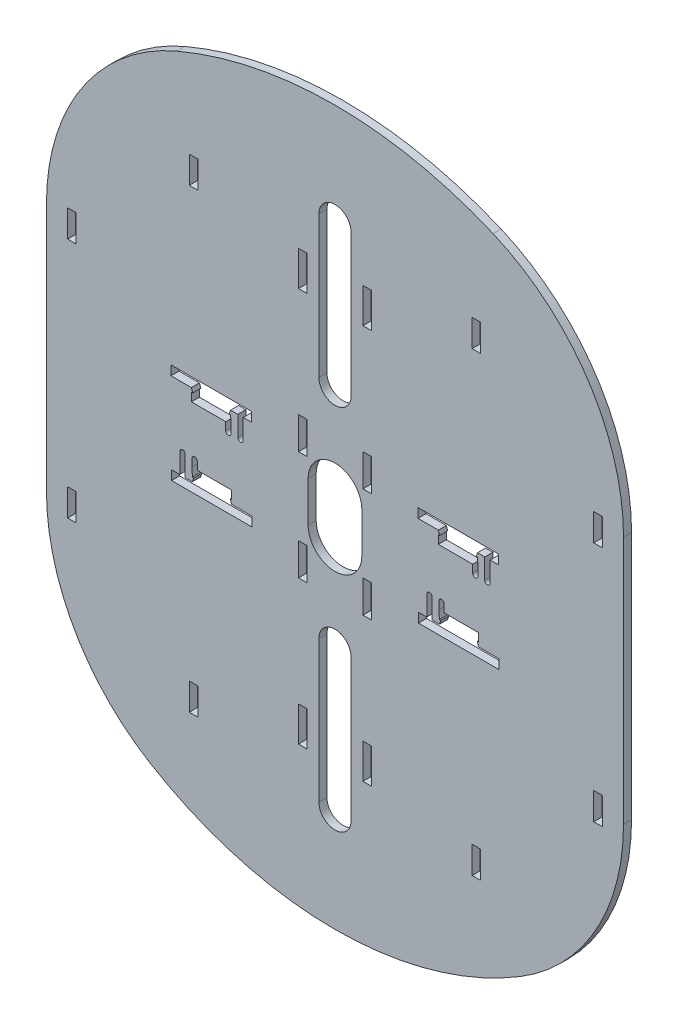
from build123d import *

# Parameters (mm, degrees)
BOSS_EXTRUDE1_DEPTH        = 3
SPINE_T_SLOTS_REACH        = 173.039
SPINE_MOUNTING_SLOTS_REACH = 173.039
SKETCH2_W                  = 3.2
SKETCH2_H                  = 12
SKETCH2_H_2                = 13
SIDE_PLATE_SLOTS_REACH     = 173.039
SKETCH5_W                  = 3.2
SKETCH5_H                  = 10.1
LINKAGE_CLEARANCE_REACH    = 173.039


with BuildPart() as part:
    # Sketch1 → Boss-Extrude1 (new body)
    with BuildSketch(Plane.XY):
        with BuildLine():
            Line((107.5, -45.307284183), (107.5, 47.371965948))
            ThreePointArc((107.5, 47.371965948), (94.261836832, 91.449819149), (58.928571429, 120.939927031))
            ThreePointArc((58.928571429, 120.939927031), (0, 133), (-58.928571429, 120.939927031))
            ThreePointArc((-58.928571429, 120.939927031), (-94.261836832, 91.449819149), (-107.5, 47.371965948))
            Line((-107.5, 47.371965948), (-107.5, -45.307284183))
            ThreePointArc((-107.5, -45.307284183), (-97.216406667, -84.545309636), (-69.009433962, -113.695637666))
            ThreePointArc((-69.009433962, -113.695637666), (0, -133), (69.009433962, -113.695637666))
            ThreePointArc((69.009433962, -113.695637666), (97.216406667, -84.545309636), (107.5, -45.307284183))
        make_face()
    extrude(amount=BOSS_EXTRUDE1_DEPTH)

    # Sketch4 → spine T-slots (cut, up to next)
    with BuildSketch(Plane.XY.offset(3), mode=Mode.PRIVATE) as spine_t_slots_sk1:
        with BuildLine():
            Line((60.9, 18.6), (30.9, 18.6))
            Line((30.9, 18.6), (30.9, 15.1))
            Line((30.9, 15.1), (38.5, 15.1))
            Line((38.5, 15.1), (39, 13.6))
            Line((39, 13.6), (38.5, 13.6))
            Line((38.5, 13.6), (38.5, 10.5))
            Line((38.5, 10.5), (51.3, 10.5))
            Line((51.3, 10.5), (51.3, 7.6))
            ThreePointArc((51.3, 7.6), (52.3, 6.6), (53.3, 7.6))
            Line((53.3, 7.6), (53.3, 10.5))
            Line((53.3, 10.5), (53.1, 13.6))
            Line((53.1, 13.6), (52.6, 13.6))
            Line((52.6, 13.6), (53.1, 15.1))
            Line((53.1, 15.1), (55.8, 15.1))
            Line((55.8, 15.1), (55.8, 7.6))
            ThreePointArc((55.8, 7.6), (56.8, 6.6), (57.8, 7.6))
            Line((57.8, 7.6), (57.8, 15.1))
            Line((57.8, 15.1), (60.9, 15.1))
            Line((60.9, 15.1), (60.9, 18.6))
        make_face()
    spine_t_slots_tool1 = extrude(spine_t_slots_sk1.sketch, amount=-SPINE_T_SLOTS_REACH, mode=Mode.PRIVATE) & part.part
    # Sketch4 → spine T-slots (cut, up to next)
    with BuildSketch(Plane.XY.offset(3), mode=Mode.PRIVATE) as spine_t_slots_sk2:
        with BuildLine():
            Line((31.1, -18.6), (61.1, -18.6))
            Line((61.1, -18.6), (61.1, -15.1))
            Line((61.1, -15.1), (53.5, -15.1))
            Line((53.5, -15.1), (53, -13.6))
            Line((53, -13.6), (53.5, -13.6))
            Line((53.5, -13.6), (53.5, -10.5))
            Line((53.5, -10.5), (40.7, -10.5))
            Line((40.7, -10.5), (40.7, -7.6))
            ThreePointArc((40.7, -7.6), (39.7, -6.6), (38.7, -7.6))
            Line((38.7, -7.6), (38.7, -10.5))
            Line((38.7, -10.5), (38.9, -13.6))
            Line((38.9, -13.6), (39.4, -13.6))
            Line((39.4, -13.6), (38.9, -15.1))
            Line((38.9, -15.1), (36.2, -15.1))
            Line((36.2, -15.1), (36.2, -7.6))
            ThreePointArc((36.2, -7.6), (35.2, -6.6), (34.2, -7.6))
            Line((34.2, -7.6), (34.2, -15.1))
            Line((34.2, -15.1), (31.1, -15.1))
            Line((31.1, -15.1), (31.1, -18.6))
        make_face()
    spine_t_slots_tool2 = extrude(spine_t_slots_sk2.sketch, amount=-SPINE_T_SLOTS_REACH, mode=Mode.PRIVATE) & part.part
    # Sketch4 → spine T-slots (cut, up to next)
    with BuildSketch(Plane.XY.offset(3), mode=Mode.PRIVATE) as spine_t_slots_sk3:
        with BuildLine():
            Line((-60.9, -18.6), (-30.9, -18.6))
            Line((-30.9, -18.6), (-30.9, -15.1))
            Line((-30.9, -15.1), (-38.5, -15.1))
            Line((-38.5, -15.1), (-39, -13.6))
            Line((-39, -13.6), (-38.5, -13.6))
            Line((-38.5, -13.6), (-38.5, -10.5))
            Line((-38.5, -10.5), (-51.3, -10.5))
            Line((-51.3, -10.5), (-51.3, -7.6))
            ThreePointArc((-51.3, -7.6), (-52.3, -6.6), (-53.3, -7.6))
            Line((-53.3, -7.6), (-53.3, -10.5))
            Line((-53.3, -10.5), (-53.1, -13.6))
            Line((-53.1, -13.6), (-52.6, -13.6))
            Line((-52.6, -13.6), (-53.1, -15.1))
            Line((-53.1, -15.1), (-55.8, -15.1))
            Line((-55.8, -15.1), (-55.8, -7.6))
            ThreePointArc((-55.8, -7.6), (-56.8, -6.6), (-57.8, -7.6))
            Line((-57.8, -7.6), (-57.8, -15.1))
            Line((-57.8, -15.1), (-60.9, -15.1))
            Line((-60.9, -15.1), (-60.9, -18.6))
        make_face()
    spine_t_slots_tool3 = extrude(spine_t_slots_sk3.sketch, amount=-SPINE_T_SLOTS_REACH, mode=Mode.PRIVATE) & part.part
    # Sketch4 → spine T-slots (cut, up to next)
    with BuildSketch(Plane.XY.offset(3), mode=Mode.PRIVATE) as spine_t_slots_sk4:
        with BuildLine():
            Line((-31.1, 18.6), (-61.1, 18.6))
            Line((-61.1, 18.6), (-61.1, 15.1))
            Line((-61.1, 15.1), (-53.5, 15.1))
            Line((-53.5, 15.1), (-53, 13.6))
            Line((-53, 13.6), (-53.5, 13.6))
            Line((-53.5, 13.6), (-53.5, 10.5))
            Line((-53.5, 10.5), (-40.7, 10.5))
            Line((-40.7, 10.5), (-40.7, 7.6))
            ThreePointArc((-40.7, 7.6), (-39.7, 6.6), (-38.7, 7.6))
            Line((-38.7, 7.6), (-38.7, 10.5))
            Line((-38.7, 10.5), (-38.9, 13.6))
            Line((-38.9, 13.6), (-39.4, 13.6))
            Line((-39.4, 13.6), (-38.9, 15.1))
            Line((-38.9, 15.1), (-36.2, 15.1))
            Line((-36.2, 15.1), (-36.2, 7.6))
            ThreePointArc((-36.2, 7.6), (-35.2, 6.6), (-34.2, 7.6))
            Line((-34.2, 7.6), (-34.2, 15.1))
            Line((-34.2, 15.1), (-31.1, 15.1))
            Line((-31.1, 15.1), (-31.1, 18.6))
        make_face()
    spine_t_slots_tool4 = extrude(spine_t_slots_sk4.sketch, amount=-SPINE_T_SLOTS_REACH, mode=Mode.PRIVATE) & part.part
    add(spine_t_slots_tool1.solids().sort_by_distance((47.0418, 14.653776, 3))[0], mode=Mode.SUBTRACT)
    add(spine_t_slots_tool2.solids().sort_by_distance((44.9582, -14.653776, 3))[0], mode=Mode.SUBTRACT)
    add(spine_t_slots_tool3.solids().sort_by_distance((-47.0418, -14.653776, 3))[0], mode=Mode.SUBTRACT)
    add(spine_t_slots_tool4.solids().sort_by_distance((-44.9582, 14.653776, 3))[0], mode=Mode.SUBTRACT)

    # Sketch2 → spine mounting slots (cut, up to next)
    with BuildSketch(Plane.XY.offset(3), mode=Mode.PRIVATE) as spine_mounting_slots_sk1:
        with Locations((12, 20.36)):
            Rectangle(SKETCH2_W, SKETCH2_H)
    spine_mounting_slots_tool1 = extrude(spine_mounting_slots_sk1.sketch, amount=-SPINE_MOUNTING_SLOTS_REACH, mode=Mode.PRIVATE) & part.part
    # Sketch2 → spine mounting slots (cut, up to next)
    with BuildSketch(Plane.XY.offset(3), mode=Mode.PRIVATE) as spine_mounting_slots_sk2:
        with Locations((12, 73.5)):
            Rectangle(SKETCH2_W, SKETCH2_H_2)
    spine_mounting_slots_tool2 = extrude(spine_mounting_slots_sk2.sketch, amount=-SPINE_MOUNTING_SLOTS_REACH, mode=Mode.PRIVATE) & part.part
    # Sketch2 → spine mounting slots (cut, up to next)
    with BuildSketch(Plane.XY.offset(3), mode=Mode.PRIVATE) as spine_mounting_slots_sk3:
        with Locations((-12, 73.5)):
            Rectangle(SKETCH2_W, SKETCH2_H_2)
    spine_mounting_slots_tool3 = extrude(spine_mounting_slots_sk3.sketch, amount=-SPINE_MOUNTING_SLOTS_REACH, mode=Mode.PRIVATE) & part.part
    # Sketch2 → spine mounting slots (cut, up to next)
    with BuildSketch(Plane.XY.offset(3), mode=Mode.PRIVATE) as spine_mounting_slots_sk4:
        with Locations((-12, 20.36)):
            Rectangle(SKETCH2_W, SKETCH2_H)
    spine_mounting_slots_tool4 = extrude(spine_mounting_slots_sk4.sketch, amount=-SPINE_MOUNTING_SLOTS_REACH, mode=Mode.PRIVATE) & part.part
    # Sketch2 → spine mounting slots (cut, up to next)
    with BuildSketch(Plane.XY.offset(3), mode=Mode.PRIVATE) as spine_mounting_slots_sk5:
        with Locations((-12, -20.36)):
            Rectangle(SKETCH2_W, SKETCH2_H)
    spine_mounting_slots_tool5 = extrude(spine_mounting_slots_sk5.sketch, amount=-SPINE_MOUNTING_SLOTS_REACH, mode=Mode.PRIVATE) & part.part
    # Sketch2 → spine mounting slots (cut, up to next)
    with BuildSketch(Plane.XY.offset(3), mode=Mode.PRIVATE) as spine_mounting_slots_sk6:
        with Locations((-12, -73.5)):
            Rectangle(SKETCH2_W, SKETCH2_H_2)
    spine_mounting_slots_tool6 = extrude(spine_mounting_slots_sk6.sketch, amount=-SPINE_MOUNTING_SLOTS_REACH, mode=Mode.PRIVATE) & part.part
    # Sketch2 → spine mounting slots (cut, up to next)
    with BuildSketch(Plane.XY.offset(3), mode=Mode.PRIVATE) as spine_mounting_slots_sk7:
        with Locations((12, -73.5)):
            Rectangle(SKETCH2_W, SKETCH2_H_2)
    spine_mounting_slots_tool7 = extrude(spine_mounting_slots_sk7.sketch, amount=-SPINE_MOUNTING_SLOTS_REACH, mode=Mode.PRIVATE) & part.part
    # Sketch2 → spine mounting slots (cut, up to next)
    with BuildSketch(Plane.XY.offset(3), mode=Mode.PRIVATE) as spine_mounting_slots_sk8:
        with Locations((12, -20.36)):
            Rectangle(SKETCH2_W, SKETCH2_H)
    spine_mounting_slots_tool8 = extrude(spine_mounting_slots_sk8.sketch, amount=-SPINE_MOUNTING_SLOTS_REACH, mode=Mode.PRIVATE) & part.part
    add(spine_mounting_slots_tool1.solids().sort_by_distance((12, 20.36, 3))[0], mode=Mode.SUBTRACT)
    add(spine_mounting_slots_tool2.solids().sort_by_distance((12, 73.5, 3))[0], mode=Mode.SUBTRACT)
    add(spine_mounting_slots_tool3.solids().sort_by_distance((-12, 73.5, 3))[0], mode=Mode.SUBTRACT)
    add(spine_mounting_slots_tool4.solids().sort_by_distance((-12, 20.36, 3))[0], mode=Mode.SUBTRACT)
    add(spine_mounting_slots_tool5.solids().sort_by_distance((-12, -20.36, 3))[0], mode=Mode.SUBTRACT)
    add(spine_mounting_slots_tool6.solids().sort_by_distance((-12, -73.5, 3))[0], mode=Mode.SUBTRACT)
    add(spine_mounting_slots_tool7.solids().sort_by_distance((12, -73.5, 3))[0], mode=Mode.SUBTRACT)
    add(spine_mounting_slots_tool8.solids().sort_by_distance((12, -20.36, 3))[0], mode=Mode.SUBTRACT)

    # Sketch5 → side plate slots (cut, up to next)
    with BuildSketch(Plane.XY.offset(3), mode=Mode.PRIVATE) as side_plate_slots_sk1:
        with Locations((52.69, 85)):
            Rectangle(SKETCH5_W, SKETCH5_H)
    side_plate_slots_tool1 = extrude(side_plate_slots_sk1.sketch, amount=-SIDE_PLATE_SLOTS_REACH, mode=Mode.PRIVATE) & part.part
    # Sketch5 → side plate slots (cut, up to next)
    with BuildSketch(Plane.XY.offset(3), mode=Mode.PRIVATE) as side_plate_slots_sk2:
        with Locations((52.69, -85)):
            Rectangle(SKETCH5_W, SKETCH5_H)
    side_plate_slots_tool2 = extrude(side_plate_slots_sk2.sketch, amount=-SIDE_PLATE_SLOTS_REACH, mode=Mode.PRIVATE) & part.part
    # Sketch5 → side plate slots (cut, up to next)
    with BuildSketch(Plane.XY.offset(3), mode=Mode.PRIVATE) as side_plate_slots_sk3:
        with Locations((-52.69, 85)):
            Rectangle(SKETCH5_W, SKETCH5_H)
    side_plate_slots_tool3 = extrude(side_plate_slots_sk3.sketch, amount=-SIDE_PLATE_SLOTS_REACH, mode=Mode.PRIVATE) & part.part
    # Sketch5 → side plate slots (cut, up to next)
    with BuildSketch(Plane.XY.offset(3), mode=Mode.PRIVATE) as side_plate_slots_sk4:
        with Locations((-52.69, -85)):
            Rectangle(SKETCH5_W, SKETCH5_H)
    side_plate_slots_tool4 = extrude(side_plate_slots_sk4.sketch, amount=-SIDE_PLATE_SLOTS_REACH, mode=Mode.PRIVATE) & part.part
    # Sketch5 → side plate slots (cut, up to next)
    with BuildSketch(Plane.XY.offset(3), mode=Mode.PRIVATE) as side_plate_slots_sk5:
        with Locations((98, 45)):
            Rectangle(SKETCH5_W, SKETCH5_H)
    side_plate_slots_tool5 = extrude(side_plate_slots_sk5.sketch, amount=-SIDE_PLATE_SLOTS_REACH, mode=Mode.PRIVATE) & part.part
    # Sketch5 → side plate slots (cut, up to next)
    with BuildSketch(Plane.XY.offset(3), mode=Mode.PRIVATE) as side_plate_slots_sk6:
        with Locations((98, -45)):
            Rectangle(SKETCH5_W, SKETCH5_H)
    side_plate_slots_tool6 = extrude(side_plate_slots_sk6.sketch, amount=-SIDE_PLATE_SLOTS_REACH, mode=Mode.PRIVATE) & part.part
    # Sketch5 → side plate slots (cut, up to next)
    with BuildSketch(Plane.XY.offset(3), mode=Mode.PRIVATE) as side_plate_slots_sk7:
        with Locations((-98, -45)):
            Rectangle(SKETCH5_W, SKETCH5_H)
    side_plate_slots_tool7 = extrude(side_plate_slots_sk7.sketch, amount=-SIDE_PLATE_SLOTS_REACH, mode=Mode.PRIVATE) & part.part
    # Sketch5 → side plate slots (cut, up to next)
    with BuildSketch(Plane.XY.offset(3), mode=Mode.PRIVATE) as side_plate_slots_sk8:
        with Locations((-98, 45)):
            Rectangle(SKETCH5_W, SKETCH5_H)
    side_plate_slots_tool8 = extrude(side_plate_slots_sk8.sketch, amount=-SIDE_PLATE_SLOTS_REACH, mode=Mode.PRIVATE) & part.part
    add(side_plate_slots_tool1.solids().sort_by_distance((52.69, 85, 3))[0], mode=Mode.SUBTRACT)
    add(side_plate_slots_tool2.solids().sort_by_distance((52.69, -85, 3))[0], mode=Mode.SUBTRACT)
    add(side_plate_slots_tool3.solids().sort_by_distance((-52.69, 85, 3))[0], mode=Mode.SUBTRACT)
    add(side_plate_slots_tool4.solids().sort_by_distance((-52.69, -85, 3))[0], mode=Mode.SUBTRACT)
    add(side_plate_slots_tool5.solids().sort_by_distance((98, 45, 3))[0], mode=Mode.SUBTRACT)
    add(side_plate_slots_tool6.solids().sort_by_distance((98, -45, 3))[0], mode=Mode.SUBTRACT)
    add(side_plate_slots_tool7.solids().sort_by_distance((-98, -45, 3))[0], mode=Mode.SUBTRACT)
    add(side_plate_slots_tool8.solids().sort_by_distance((-98, 45, 3))[0], mode=Mode.SUBTRACT)

    # Sketch3 → linkage clearance (cut, up to next)
    with BuildSketch(Plane.XY.offset(3), mode=Mode.PRIVATE) as linkage_clearance_sk1:
        with BuildLine():
            Line((-6, -94.913476789), (-6, -42.110007057))
            ThreePointArc((-6, -42.110007057), (0, -36.110007057), (6, -42.110007057))
            Line((6, -42.110007057), (6, -94.913476789))
            ThreePointArc((6, -94.913476789), (0, -100.913476789), (-6, -94.913476789))
        make_face()
    linkage_clearance_tool1 = extrude(linkage_clearance_sk1.sketch, amount=-LINKAGE_CLEARANCE_REACH, mode=Mode.PRIVATE) & part.part
    # Sketch3 → linkage clearance (cut, up to next)
    with BuildSketch(Plane.XY.offset(3), mode=Mode.PRIVATE) as linkage_clearance_sk2:
        with BuildLine():
            Line((-6, 94.913476789), (-6, 42.110007057))
            ThreePointArc((-6, 42.110007057), (0, 36.110007057), (6, 42.110007057))
            Line((6, 42.110007057), (6, 94.913476789))
            ThreePointArc((6, 94.913476789), (0, 100.913476789), (-6, 94.913476789))
        make_face()
    linkage_clearance_tool2 = extrude(linkage_clearance_sk2.sketch, amount=-LINKAGE_CLEARANCE_REACH, mode=Mode.PRIVATE) & part.part
    # Sketch3 → linkage clearance (cut, up to next)
    with BuildSketch(Plane.XY.offset(3), mode=Mode.PRIVATE) as linkage_clearance_sk3:
        with BuildLine():
            Line((10, 7.5), (10, -7.5))
            ThreePointArc((10, -7.5), (0, -17.5), (-10, -7.5))
            Line((-10, -7.5), (-10, 7.5))
            ThreePointArc((-10, 7.5), (0, 17.5), (10, 7.5))
        make_face()
    linkage_clearance_tool3 = extrude(linkage_clearance_sk3.sketch, amount=-LINKAGE_CLEARANCE_REACH, mode=Mode.PRIVATE) & part.part
    add(linkage_clearance_tool1.solids().sort_by_distance((0, -68.511742, 3))[0], mode=Mode.SUBTRACT)
    add(linkage_clearance_tool2.solids().sort_by_distance((0, 68.511742, 3))[0], mode=Mode.SUBTRACT)
    add(linkage_clearance_tool3.solids().sort_by_distance((0, 0, 3))[0], mode=Mode.SUBTRACT)


solid = part.part
